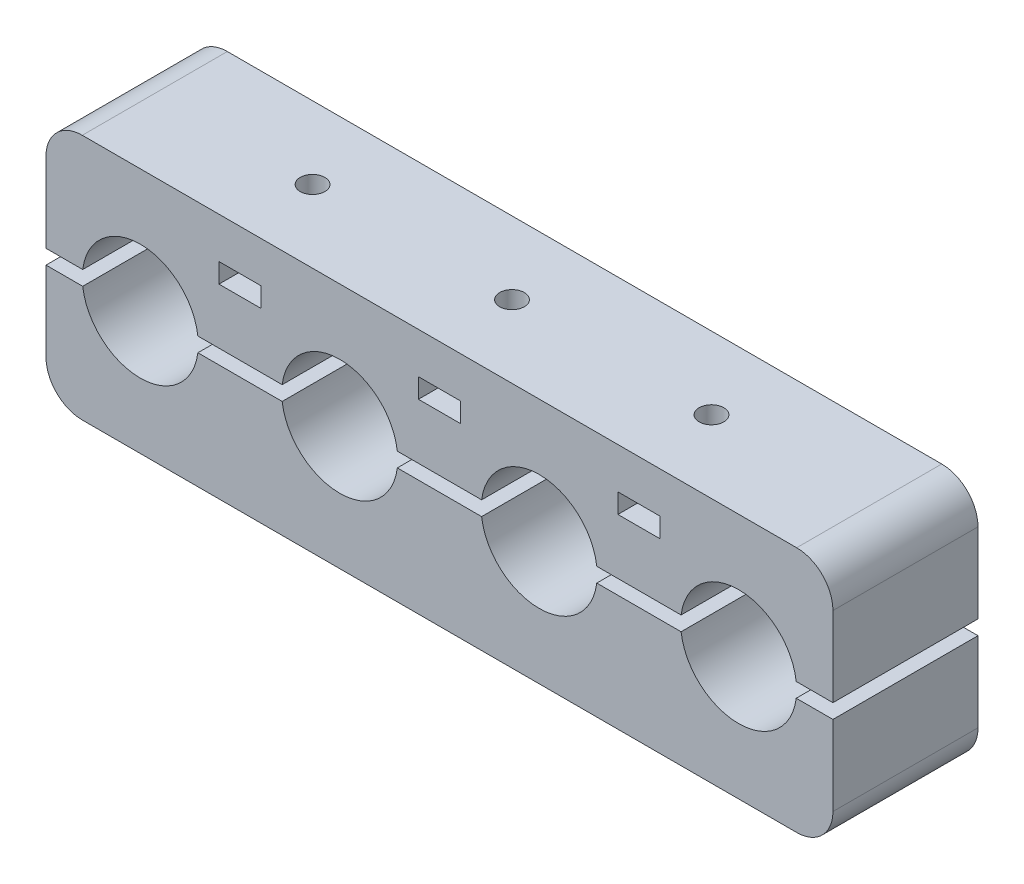
from build123d import *

# Parameters (mm, degrees)
ESTRUSIONE_ESTRUSIONE1_DEPTH   = 20
ESTRUSIONE_ESTRUSIONE1_2_DEPTH = 20
SCHIZZO2_W                     = 5.8
SCHIZZO2_H                     = 2.7
TAGLIO_ESTRUSIONE1_DEPTH       = 20
FORO_PER_VITE_M3_1_AT_2_COUNT  = 2
FORO_PER_VITE_M3_1_AT_2_PITCH  = 27.5
FORO_PER_VITE_M3_1_AT_3_COUNT  = 2
FORO_PER_VITE_M3_1_AT_3_PITCH  = 55


with BuildPart() as part:
    # Schizzo1 → Estrusione-Estrusione1 (new body)
    with BuildSketch(Plane.XY):
        with BuildLine():
            Line((90.5, 17), (-8, 17))
            ThreePointArc((-8, 17), (-11.535533906, 15.535533906), (-13, 12))
            Line((-13, 12), (-13, 1))
            Line((-13, 1), (-7.937253933, 1))
            ThreePointArc((-7.937253933, 1), (0, 8), (7.937253933, 1))
            Line((7.937253933, 1), (19.562746067, 1))
            ThreePointArc((19.562746067, 1), (27.5, 8), (35.437253933, 1))
            Line((35.437253933, 1), (47.062746067, 1))
            ThreePointArc((47.062746067, 1), (55, 8), (62.937253933, 1))
            Line((62.937253933, 1), (74.562746067, 1))
            ThreePointArc((74.562746067, 1), (82.5, 8), (90.437253933, 1))
            Line((90.437253933, 1), (95.5, 1))
            Line((95.5, 1), (95.5, 12))
            ThreePointArc((95.5, 12), (94.035533906, 15.535533906), (90.5, 17))
        make_face()
    extrude(amount=ESTRUSIONE_ESTRUSIONE1_DEPTH)

    # Schizzo2 → Taglio-Estrusione1 (cut)
    with BuildSketch(Plane.XY.offset(20)):
        with Locations((13.75, 10)):
            Rectangle(SCHIZZO2_W, SCHIZZO2_H)
        with Locations((41.25, 10)):
            Rectangle(SCHIZZO2_W, SCHIZZO2_H)
        with Locations((68.75, 10)):
            Rectangle(SCHIZZO2_W, SCHIZZO2_H)
    extrude(amount=-TAGLIO_ESTRUSIONE1_DEPTH, mode=Mode.SUBTRACT)


with BuildPart() as body_2:
    # Schizzo1 → Estrusione-Estrusione1 2 (new body)
    with BuildSketch(Plane.XY):
        with BuildLine():
            Line((-7.937253933, -1), (-13, -1))
            Line((-13, -1), (-13, -12))
            ThreePointArc((-13, -12), (-11.535533906, -15.535533906), (-8, -17))
            Line((-8, -17), (90.5, -17))
            ThreePointArc((90.5, -17), (94.035533906, -15.535533906), (95.5, -12))
            Line((95.5, -12), (95.5, -1))
            Line((95.5, -1), (90.437253933, -1))
            ThreePointArc((90.437253933, -1), (82.5, -8), (74.562746067, -1))
            Line((74.562746067, -1), (62.937253933, -1))
            ThreePointArc((62.937253933, -1), (55, -8), (47.062746067, -1))
            Line((47.062746067, -1), (35.437253933, -1))
            ThreePointArc((35.437253933, -1), (27.5, -8), (19.562746067, -1))
            Line((19.562746067, -1), (7.937253933, -1))
            ThreePointArc((7.937253933, -1), (0, -8), (-7.937253933, -1))
        make_face()
    extrude(amount=ESTRUSIONE_ESTRUSIONE1_2_DEPTH)


with BuildPart() as foro_per_vite_m3_1_tool:
    # Schizzo5 → Foro per Vite M3-1 (revolve)
    with BuildSketch(Plane(origin=(68.75, -17, 10), x_dir=(0, 0, -1), z_dir=(1, 0, 0))):
        Polygon((0, 0), (0, 40), (1.7, 38.978536948), (1.7, 0), align=None)
    foro_per_vite_m3_1 = revolve(axis=Axis((68.75, -23.35, 10), (0, 1, 0)))


with BuildPart() as part_1:
    add(part.part)

    # Foro per Vite M3-1: cut by foro_per_vite_m3_1_tool
    add(foro_per_vite_m3_1_tool.part, mode=Mode.SUBTRACT)


with BuildPart() as body_2_1:
    add(body_2.part)

    # Foro per Vite M3-1: cut by foro_per_vite_m3_1_tool
    add(foro_per_vite_m3_1_tool.part, mode=Mode.SUBTRACT)


with BuildPart() as foro_per_vite_m3_1_at_2_tool:
    # Foro per Vite M3-1 at 2: Foro per Vite M3-1 ×2
    with Locations(*[(-i * FORO_PER_VITE_M3_1_AT_2_PITCH, 0, 0) for i in range(1, FORO_PER_VITE_M3_1_AT_2_COUNT)]):
        add(foro_per_vite_m3_1)


with BuildPart() as part_2:
    add(part_1.part)

    # Foro per Vite M3-1 at 2: cut by foro_per_vite_m3_1_at_2_tool
    add(foro_per_vite_m3_1_at_2_tool.part, mode=Mode.SUBTRACT)


with BuildPart() as body_2_2:
    add(body_2_1.part)

    # Foro per Vite M3-1 at 2: cut by foro_per_vite_m3_1_at_2_tool
    add(foro_per_vite_m3_1_at_2_tool.part, mode=Mode.SUBTRACT)


with BuildPart() as foro_per_vite_m3_1_at_3_tool:
    # Foro per Vite M3-1 at 3: Foro per Vite M3-1 ×2
    with Locations(*[(-i * FORO_PER_VITE_M3_1_AT_3_PITCH, 0, 0) for i in range(1, FORO_PER_VITE_M3_1_AT_3_COUNT)]):
        add(foro_per_vite_m3_1)


with BuildPart() as part_3:
    add(part_2.part)

    # Foro per Vite M3-1 at 3: cut by foro_per_vite_m3_1_at_3_tool
    add(foro_per_vite_m3_1_at_3_tool.part, mode=Mode.SUBTRACT)


with BuildPart() as body_2_3:
    add(body_2_2.part)

    # Foro per Vite M3-1 at 3: cut by foro_per_vite_m3_1_at_3_tool
    add(foro_per_vite_m3_1_at_3_tool.part, mode=Mode.SUBTRACT)


solid = Compound([part_3.part, body_2_3.part])
